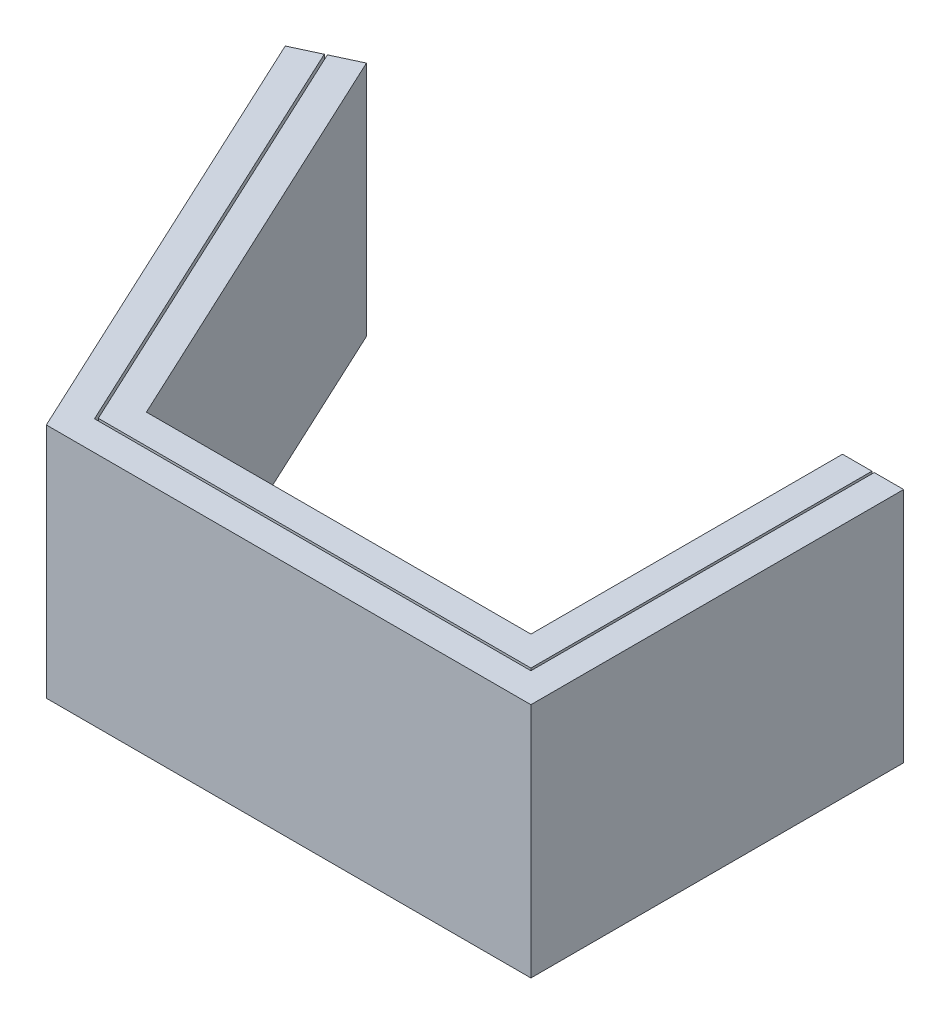
from build123d import *

# Parameters (mm, degrees)
SALIENTE_EXTRUIR1_DEPTH = 50.8
SALIENTE_EXTRUIR2_DEPTH = 50.8


with BuildPart() as part:
    # Croquis1 → Saliente-Extruir1 (new body)
    with BuildSketch(Plane(origin=(0, 0, 0), x_dir=(1, 0, 0), z_dir=(0, 1, 0))):
        Polygon((0, 0), (-104, 0), (-148.797535745, 96.068625426), (-143.078733608, 98.735346657), (-99.980086654, 6.31), (-6.31, 6.31), (-6.31, 80), (0, 80), align=None)
    extrude(amount=SALIENTE_EXTRUIR1_DEPTH)


with BuildPart() as body_2:
    # Croquis2 → Saliente-Extruir2 (new body)
    with BuildSketch(Plane(origin=(0, 50.8, 0), x_dir=(1, 0, 0), z_dir=(0, 1, 0))):
        Polygon((-142.625579715, 98.946655788), (-99.661551524, 6.81), (-6.81, 6.81), (-6.81, 80), (-13.12, 80), (-13.12, 13.12), (-95.641638178, 13.12), (-136.906777579, 101.61337702), align=None)
    extrude(amount=-SALIENTE_EXTRUIR2_DEPTH)


solid = Compound([part.part, body_2.part])
